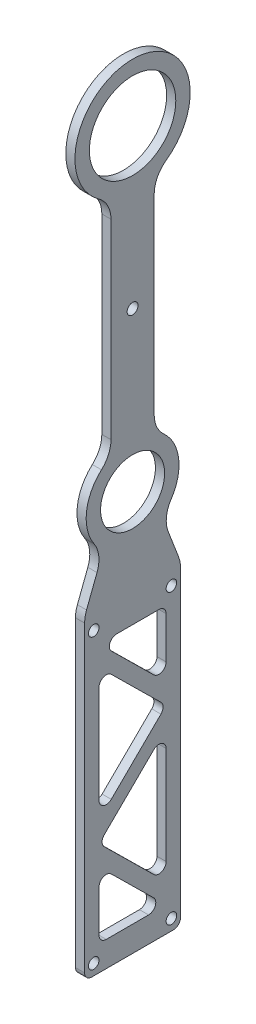
from build123d import *

# Parameters (mm, degrees)
SKETCH1_R             = 15
SKETCH1_R_2           = 1.8288
SKETCH1_R_3           = 11.1125
BOSS_EXTRUDE1_DEPTH   = 3.175
CUT_EXTRUDE1_REACH    = 168.331
SKETCH2_W             = 4.112404804
SKETCH2_H             = 127.6975
FILLET3_R             = 2.5
FILLET4_R             = 10
F_6_CLEARANCE_HOLE1_D = 3.7973


with BuildPart() as part:
    # Sketch1 → Boss-Extrude1 (new body)
    with BuildSketch(Plane(origin=(0, 0, 0), x_dir=(0, 0, -1), z_dir=(1, 0, 0))):
        with BuildLine():
            Line((20.757404804, -103.81), (20.757404804, -5))
            Line((20.757404804, -5), (10.169330134, 22.502104942))
            ThreePointArc((10.169330134, 22.502104942), (16.03292259, 36.599390347), (7.5, 49.260527909))
            Line((7.5, 49.260527909), (7.5, 126.459503782))
            ThreePointArc((7.5, 126.459503782), (0, 165), (-7.5, 126.459503782))
            Line((-7.5, 126.459503782), (-7.5, 49.260527909))
            ThreePointArc((-7.5, 49.260527909), (-16.03292259, 36.599390347), (-10.169330134, 22.502104942))
            Line((-10.169330134, 22.502104942), (-20.757404804, -5))
            Line((-20.757404804, -5), (-20.757404804, -103.81))
            Line((-20.757404804, -103.81), (20.757404804, -103.81))
        make_face()
        with Locations((0, 145)):
            Circle(SKETCH1_R, mode=Mode.SUBTRACT)
        with Locations((-13.4747, -100)):
            Circle(SKETCH1_R_2, mode=Mode.SUBTRACT)
        with Locations((13.4747, -100)):
            Circle(SKETCH1_R_2, mode=Mode.SUBTRACT)
        with Locations((-13.4747, 0)):
            Circle(SKETCH1_R_2, mode=Mode.SUBTRACT)
        with Locations((13.4747, 0)):
            Circle(SKETCH1_R_2, mode=Mode.SUBTRACT)
        with Locations((0, 35)):
            Circle(SKETCH1_R_3, mode=Mode.SUBTRACT)
    extrude(amount=BOSS_EXTRUDE1_DEPTH)

    # Sketch2 → Cut-Extrude1 (cut, up to next)
    with BuildSketch(Plane(origin=(3.175, 0, 0), x_dir=(0, 0, -1), z_dir=(1, 0, 0)), mode=Mode.PRIVATE) as cut_extrude1_sk1:
        Polygon((11.645, -5), (-11.645, -5), (11.645, -27.976379872), align=None)
    cut_extrude1_tool1 = extrude(cut_extrude1_sk1.sketch, amount=-CUT_EXTRUDE1_REACH, mode=Mode.PRIVATE) & part.part
    # Sketch2 → Cut-Extrude1 (cut, up to next)
    with BuildSketch(Plane(origin=(3.175, 0, 0), x_dir=(0, 0, -1), z_dir=(1, 0, 0)), mode=Mode.PRIVATE) as cut_extrude1_sk2:
        Polygon((-11.645, -12.023620128), (11.645, -35), (-11.645, -57.976379872), (-11.645, -35), align=None)
    cut_extrude1_tool2 = extrude(cut_extrude1_sk2.sketch, amount=-CUT_EXTRUDE1_REACH, mode=Mode.PRIVATE) & part.part
    # Sketch2 → Cut-Extrude1 (cut, up to next)
    with BuildSketch(Plane(origin=(3.175, 0, 0), x_dir=(0, 0, -1), z_dir=(1, 0, 0)), mode=Mode.PRIVATE) as cut_extrude1_sk3:
        Polygon((-11.645, -72.023620128), (-11.645, -95), (11.645, -95), align=None)
    cut_extrude1_tool3 = extrude(cut_extrude1_sk3.sketch, amount=-CUT_EXTRUDE1_REACH, mode=Mode.PRIVATE) & part.part
    # Sketch2 → Cut-Extrude1 (cut, up to next)
    with BuildSketch(Plane(origin=(3.175, 0, 0), x_dir=(0, 0, -1), z_dir=(1, 0, 0)), mode=Mode.PRIVATE) as cut_extrude1_sk4:
        Polygon((11.645, -42.023620128), (11.645, -65), (11.645, -87.976379872), (-11.645, -65), align=None)
    cut_extrude1_tool4 = extrude(cut_extrude1_sk4.sketch, amount=-CUT_EXTRUDE1_REACH, mode=Mode.PRIVATE) & part.part
    # Sketch2 → Cut-Extrude1 (cut, up to next)
    with BuildSketch(Plane(origin=(3.175, 0, 0), x_dir=(0, 0, -1), z_dir=(1, 0, 0)), mode=Mode.PRIVATE) as cut_extrude1_sk5:
        with Locations((-18.701202402, -39.96125)):
            Rectangle(SKETCH2_W, SKETCH2_H)
    cut_extrude1_tool5 = extrude(cut_extrude1_sk5.sketch, amount=-CUT_EXTRUDE1_REACH, mode=Mode.PRIVATE) & part.part
    # Sketch2 → Cut-Extrude1 (cut, up to next)
    with BuildSketch(Plane(origin=(3.175, 0, 0), x_dir=(0, 0, -1), z_dir=(1, 0, 0)), mode=Mode.PRIVATE) as cut_extrude1_sk6:
        with Locations((18.701202402, -39.96125)):
            Rectangle(SKETCH2_W, SKETCH2_H)
    cut_extrude1_tool6 = extrude(cut_extrude1_sk6.sketch, amount=-CUT_EXTRUDE1_REACH, mode=Mode.PRIVATE) & part.part
    add(cut_extrude1_tool1.solids().sort_by_distance((3.175, -12.658793, -3.881667))[0], mode=Mode.SUBTRACT)
    add(cut_extrude1_tool2.solids().sort_by_distance((3.175, -35, 3.881667))[0], mode=Mode.SUBTRACT)
    add(cut_extrude1_tool3.solids().sort_by_distance((3.175, -87.341207, 3.881667))[0], mode=Mode.SUBTRACT)
    add(cut_extrude1_tool4.solids().sort_by_distance((3.175, -65, -3.881667))[0], mode=Mode.SUBTRACT)
    add(cut_extrude1_tool5.solids().sort_by_distance((3.175, -39.96125, 18.701202))[0], mode=Mode.SUBTRACT)
    add(cut_extrude1_tool6.solids().sort_by_distance((3.175, -39.96125, -18.701202))[0], mode=Mode.SUBTRACT)

    # Fillet3
    fillet3_edges = [part.edges().sort_by_distance(p)[0] for p in [
        (1.5875, -103.81, -16.645),
        (1.5875, -72.023620128, 11.645),
        (1.5875, -95, -11.645),
        (1.5875, -95, 11.645),
        (1.5875, -87.976379872, -11.645),
        (1.5875, -65, 11.645),
        (1.5875, -42.023620128, -11.645),
        (1.5875, -27.976379872, -11.645),
        (1.5875, -5, 11.645),
        (1.5875, -5, -11.645),
        (1.5875, -103.81, 16.645),
        (1.5875, -12.023620128, 11.645),
        (1.5875, -35, -11.645),
        (1.5875, -57.976379872, 11.645),
    ]]
    fillet(fillet3_edges, radius=FILLET3_R)

    # Fillet4
    fillet4_edges = [part.edges().sort_by_distance(p)[0] for p in [
        (1.5875, 5.681808734, -16.645),
        (1.5875, 22.502104942, 10.169330134),
        (1.5875, 49.260527909, 7.5),
        (1.5875, 126.459503782, 7.5),
        (1.5875, 126.459503782, -7.5),
        (1.5875, 49.260527909, -7.5),
        (1.5875, 22.502104942, -10.169330134),
        (1.5875, 5.681808734, 16.645),
    ]]
    fillet(fillet4_edges, radius=FILLET4_R)

    # #6 Clearance Hole1 (through all)
    with Locations(Plane(origin=(3.175, 0, 0), x_dir=(0, 0, -1), z_dir=(1, 0, 0))):
        with Locations((0, 90)):
            Hole(F_6_CLEARANCE_HOLE1_D / 2)


solid = part.part
